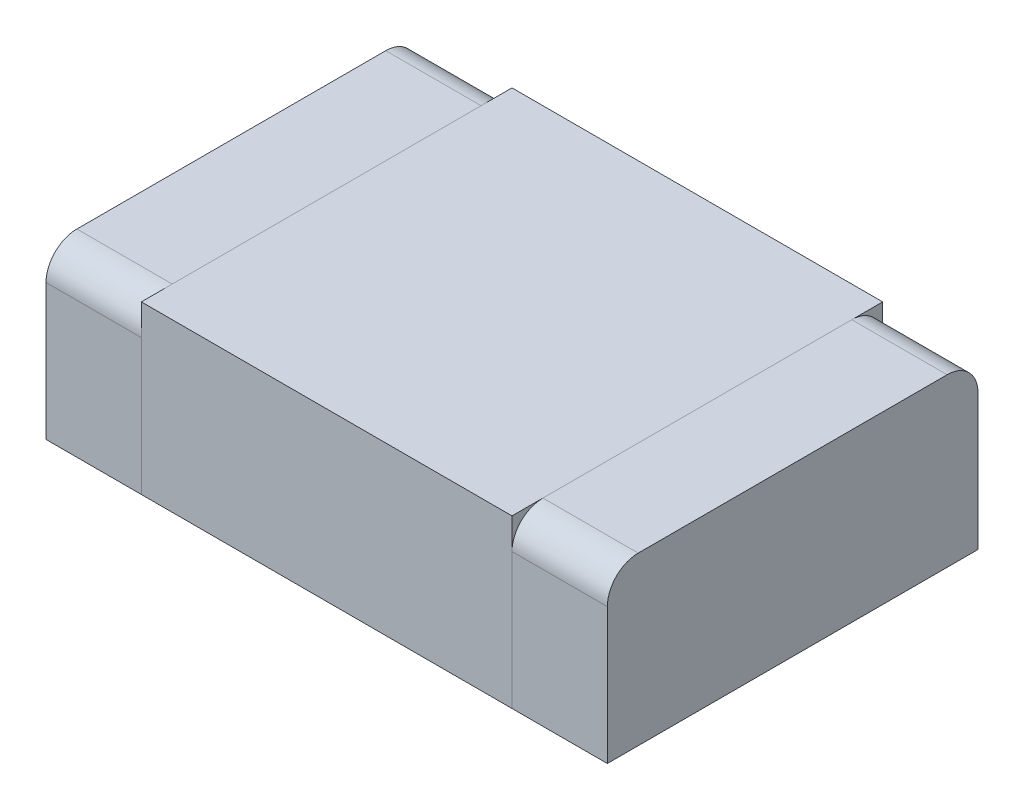
from build123d import *

# Parameters (mm, degrees)
SKETCH1_W               = 1.2
SKETCH1_H               = 1.2
BOSS_EXTRUDE1_DEPTH     = 0.54
BOSS_EXTRUDE2_DEPTH     = 0.54
BOSS_EXTRUDE2_2_DEPTH   = 0.54
CUT_EXTRUDE1_DEPTH      = 2.215389489
CUT_EXTRUDE1_DEPTH_BACK = 2.215389489
SKETCH3_W               = 1.2
SKETCH3_H               = 0.20289259
SKETCH3_H_2             = 0.053466756
FILLET1_R               = 0.1
FILLET2_R               = 0.1


with BuildPart() as part:
    # Sketch1 → Boss-Extrude1 (new body)
    with BuildSketch(Plane(origin=(0, 0, 0), x_dir=(1, 0, 0), z_dir=(0, 1, 0))):
        Rectangle(SKETCH1_W, SKETCH1_H)
    extrude(amount=BOSS_EXTRUDE1_DEPTH)


with BuildPart() as body_2:
    # Sketch2 → Boss-Extrude2 (new body)
    with BuildSketch(Plane(origin=(0, 0, 0), x_dir=(1, 0, 0), z_dir=(0, 1, 0))):
        Polygon((-0.6, 0.6), (-0.908609713, 0.6), (-0.908609713, -0.6), (-0.6, -0.6), (-0.6, -0.061558224), (-0.411941676, -0.061558224), (-0.411941676, -0.377385392), (0.00816314, -0.377385392), (0.00816314, 0.233846892), (-0.411941676, 0.233846892), (-0.411941676, 0.061558224), (-0.6, 0.061558224), align=None)
    extrude(amount=BOSS_EXTRUDE2_DEPTH)


with BuildPart() as body_3:
    # Sketch2 → Boss-Extrude2 2 (new body)
    with BuildSketch(Plane(origin=(0, 0, 0), x_dir=(1, 0, 0), z_dir=(0, 1, 0))):
        Polygon((0.6, 0.6), (0.908609713, 0.6), (0.908609713, -0.6), (0.6, -0.6), (0.6, -0.061558224), (0.547799444, -0.061558224), (0.547799444, -0.395918118), (0.051747501, -0.395918118), (0.051747501, 0.289165444), (-0.284615443, 0.289165444), (-0.284615443, 0.443611426), (0.547799444, 0.443611426), (0.547799444, 0.061558224), (0.6, 0.061558224), align=None)
    extrude(amount=BOSS_EXTRUDE2_2_DEPTH)


with BuildPart() as cut_extrude1_tool:
    # Sketch3 → Cut-Extrude1 (new, two sides: drawn at the far end of the back side and taken through both)
    with BuildSketch(Plane.XY.offset(-CUT_EXTRUDE1_DEPTH_BACK)):
        with Locations((0, 0.101446295)):
            Rectangle(SKETCH3_W, SKETCH3_H)
        with Locations((0, 0.513266622)):
            Rectangle(SKETCH3_W, SKETCH3_H_2)
    extrude(amount=CUT_EXTRUDE1_DEPTH + CUT_EXTRUDE1_DEPTH_BACK)


with BuildPart() as body_2_1:
    add(body_2.part)

    # Cut-Extrude1: cut by cut_extrude1_tool
    add(cut_extrude1_tool.part, mode=Mode.SUBTRACT)

    # Fillet1
    fillet1_edges = [body_2_1.edges().sort_by_distance(p)[0] for p in [
        (-0.754304856, 0.54, 0.6),
        (-0.754304856, 0.54, -0.6),
    ]]
    fillet(fillet1_edges, radius=FILLET1_R)


with BuildPart() as body_3_1:
    add(body_3.part)

    # Cut-Extrude1: cut by cut_extrude1_tool
    add(cut_extrude1_tool.part, mode=Mode.SUBTRACT)

    # Fillet2
    fillet2_edges = [body_3_1.edges().sort_by_distance(p)[0] for p in [
        (0.754304856, 0.54, 0.6),
        (0.754304856, 0.54, -0.6),
    ]]
    fillet(fillet2_edges, radius=FILLET2_R)


solid = Compound([part.part, body_2_1.part, body_3_1.part])
